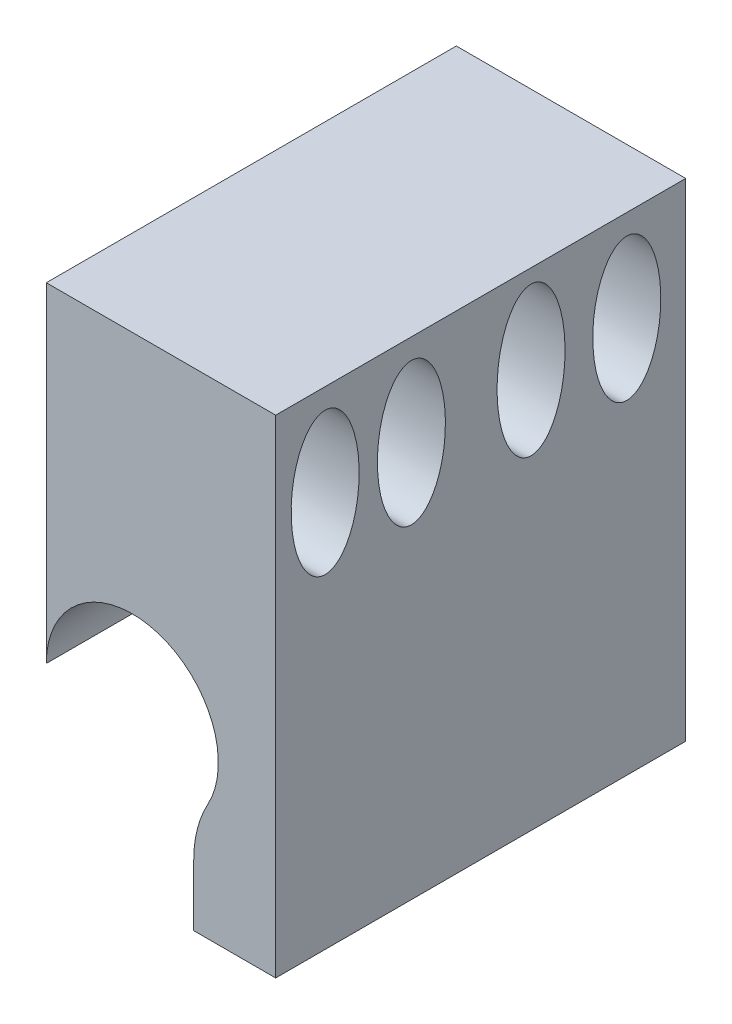
from build123d import *

# Parameters (mm, degrees)
SKETCH_1_W               = 16
SKETCH_1_H               = 34
EXTRUDE_1_DEPTH          = 28.6
CUT_EXTRUDE_3_DEPTH      = 48.222452287
CUT_EXTRUDE_3_DEPTH_BACK = 48.222452287
SKETCH_5_W               = 28.6
SKETCH_5_H               = 11
CUT_EXTRUDE_4_DEPTH      = 2
CUT_EXTRUDE_5_DEPTH      = 48.222452287
CUT_EXTRUDE_5_DEPTH_BACK = 48.222452287
SKETCH_9_RX              = 4.963641166
SKETCH_9_RY              = 2.372005513
CUT_EXTRUDE_6_DEPTH      = 48.222452453
CUT_EXTRUDE_6_DEPTH_BACK = 48.222452453
SKETCH_9_3_RX            = 4.963641166
SKETCH_9_3_RY            = 2.372005513
SKETCH_9_3_RX_2          = 5.183271306


with BuildPart() as part:
    # 草图1 → 凸台-拉伸1 (new body)
    with BuildSketch(Plane.XY):
        with Locations((8, -17)):
            Rectangle(SKETCH_1_W, SKETCH_1_H)
    extrude(amount=EXTRUDE_1_DEPTH)

    # 草图2 → 切除-拉伸3 (cut, two sides: drawn at the far end of the back side and taken through both)
    with BuildSketch(Plane.XY.offset(28.6).offset(-CUT_EXTRUDE_3_DEPTH_BACK)):
        with BuildLine():
            Line((10.284151777, -34), (10.284151777, -29.7156247))
            ThreePointArc((10.284151777, -29.7156247), (10.533147893, -27.735236154), (11.264636476, -25.878124872))
            ThreePointArc((11.264636476, -25.878124872), (7.278286447, -17.137749258), (0.015079207, -23.4251154))
            Line((0.015079207, -23.4251154), (0, -34))
            Line((0, -34), (10.284151777, -34))
        make_face()
    extrude(amount=CUT_EXTRUDE_3_DEPTH + CUT_EXTRUDE_3_DEPTH_BACK, mode=Mode.SUBTRACT)


with BuildPart() as cut_extrude_3_piece_1:
    # of the separate pieces the step leaves, piece 1, a body of its own (cut_extrude_3_pieces)
    add(part.part.solids().sort_by_distance((0, 0, 0))[0])

    # 草图9 → 切除-拉伸5 (cut, two sides: drawn at the far end of the back side and taken through both)
    with BuildSketch(Plane.ZY.offset(-CUT_EXTRUDE_5_DEPTH_BACK)):
        with Locations(Location((4.109179501, -6.391876735), (0, 0, -90))):
            Ellipse(SKETCH_9_RX, SKETCH_9_RY)
    extrude(amount=CUT_EXTRUDE_5_DEPTH + CUT_EXTRUDE_5_DEPTH_BACK, mode=Mode.SUBTRACT)

    # 草图9<3> → 切除-拉伸6 (cut, two sides: drawn at the far end of the back side and taken through both)
    with BuildSketch(Plane.ZY.offset(-CUT_EXTRUDE_6_DEPTH_BACK)):
        with Locations(Location((4.109179501, -6.391876735), (0, 0, -90))):
            Ellipse(SKETCH_9_3_RX, SKETCH_9_3_RY)
        with Locations(Location((10.785935759, -6.172246595), (0, 0, 90))):
            Ellipse(SKETCH_9_3_RX_2, SKETCH_9_3_RY)
        with Locations(Location((19.131881081, -6.391876735), (0, 0, -90))):
            Ellipse(SKETCH_9_3_RX, SKETCH_9_3_RY)
        with Locations(Location((25.149746919, -6.391876735), (0, 0, -90))):
            Ellipse(SKETCH_9_3_RX, SKETCH_9_3_RY)
    extrude(amount=CUT_EXTRUDE_6_DEPTH + CUT_EXTRUDE_6_DEPTH_BACK, mode=Mode.SUBTRACT)


with BuildPart() as cut_extrude_3_piece_2:
    # of the separate pieces the step leaves, piece 2, a body of its own (cut_extrude_3_pieces)
    add(part.part.solids().sort_by_distance((0, -34, 0))[0])

    # 草图5 → 切除-拉伸4 (cut)
    with BuildSketch(Plane.ZY):
        with Locations((14.3, -28.5)):
            Rectangle(SKETCH_5_W, SKETCH_5_H)
    extrude(amount=-CUT_EXTRUDE_4_DEPTH, mode=Mode.SUBTRACT)


solid = cut_extrude_3_piece_1.part
